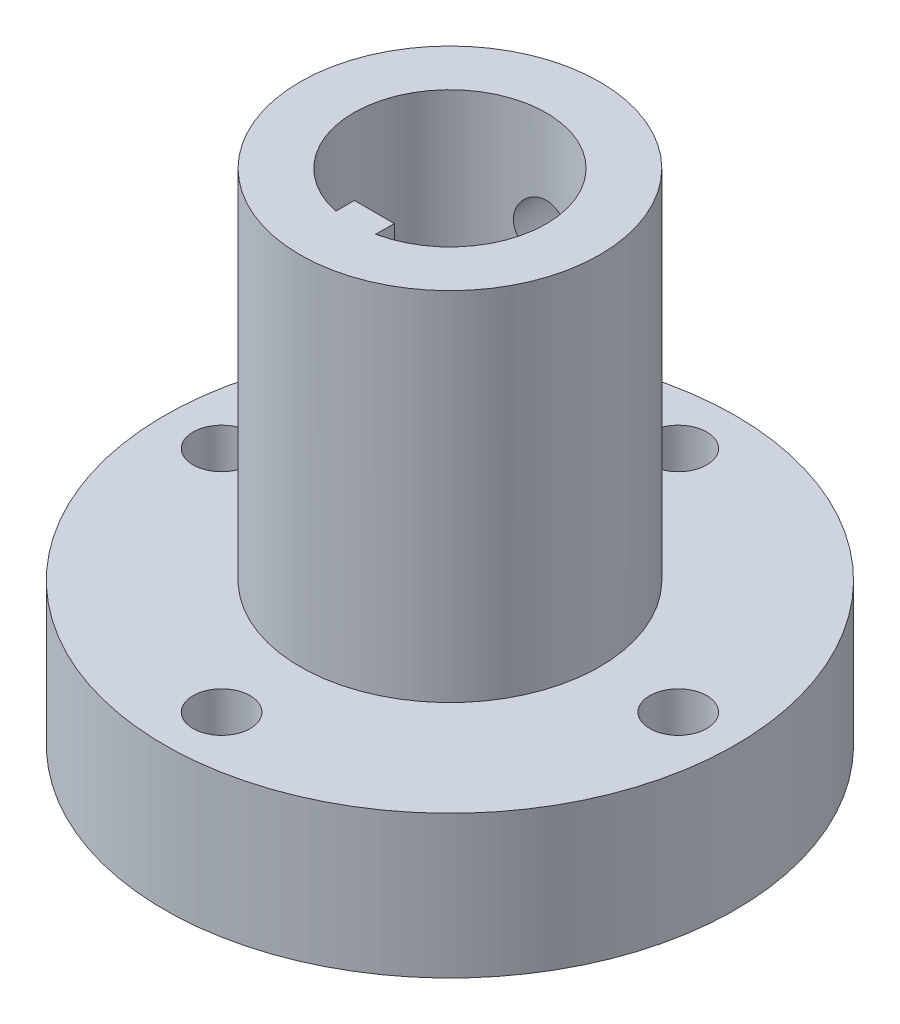
from build123d import *

# Parameters (mm, degrees)
SKETCH1_R           = 10.5
BOSS_EXTRUDE1_DEPTH = 25
SKETCH4_R           = 20
BOSS_EXTRUDE2_DEPTH = 10
SKETCH5_R           = 6.75
CUT_EXTRUDE1_DEPTH  = 46
SKETCH6_W           = 2.8
SKETCH6_H           = 2.9
BOSS_EXTRUDE3_DEPTH = 35
SKETCH7_R           = 2
CUT_EXTRUDE2_DEPTH  = 10
SKETCH8_R           = 2
CUT_EXTRUDE3_DEPTH  = 20


with BuildPart() as part:
    # Sketch1 → Boss-Extrude1 (new body)
    with BuildSketch(Plane(origin=(0, 0, 0), x_dir=(1, 0, 0), z_dir=(0, 1, 0))):
        with Locations(Location((0, 0, 0), (0, 0, 270))):
            Circle(SKETCH1_R)
    extrude(amount=BOSS_EXTRUDE1_DEPTH)

    # Sketch4 → Boss-Extrude2 (add)
    with BuildSketch(Plane.XZ):
        with Locations(Location((0, 0, 0), (0, 0, 270))):
            Circle(SKETCH4_R)
    extrude(amount=BOSS_EXTRUDE2_DEPTH)

    # Sketch5 → Cut-Extrude1 (cut, through all)
    with BuildSketch(Plane(origin=(0, 25, 0), x_dir=(1, 0, 0), z_dir=(0, 1, 0))):
        with Locations(Location((0, 0, 0), (0, 0, 270))):
            Circle(SKETCH5_R)
    extrude(amount=-CUT_EXTRUDE1_DEPTH, mode=Mode.SUBTRACT)

    # Sketch6 → Boss-Extrude3 (add, through all)
    with BuildSketch(Plane(origin=(0, 25, 0), x_dir=(1, 0, 0), z_dir=(0, 1, 0))):
        with Locations((0, -6.75)):
            Rectangle(SKETCH6_W, SKETCH6_H)
    extrude(amount=-BOSS_EXTRUDE3_DEPTH)

    # Sketch7 → Cut-Extrude2 (cut)
    with BuildSketch(Plane.XZ.offset(10)):
        with Locations(Location((0, 16, 0), (0, 0, 270))):
            Circle(SKETCH7_R)
        with Locations(Location((16, 0, 0), (0, 0, 270))):
            Circle(SKETCH7_R)
        with Locations(Location((0, -16, 0), (0, 0, 270))):
            Circle(SKETCH7_R)
        with Locations(Location((-16, 0, 0), (0, 0, 270))):
            Circle(SKETCH7_R)
    extrude(amount=-CUT_EXTRUDE2_DEPTH, mode=Mode.SUBTRACT)

    # Sketch8 → Cut-Extrude3 (cut)
    with BuildSketch(Plane.XY):
        with Locations((0, 17.687279486)):
            Circle(SKETCH8_R)
    extrude(amount=-CUT_EXTRUDE3_DEPTH, mode=Mode.SUBTRACT)


solid = part.part
